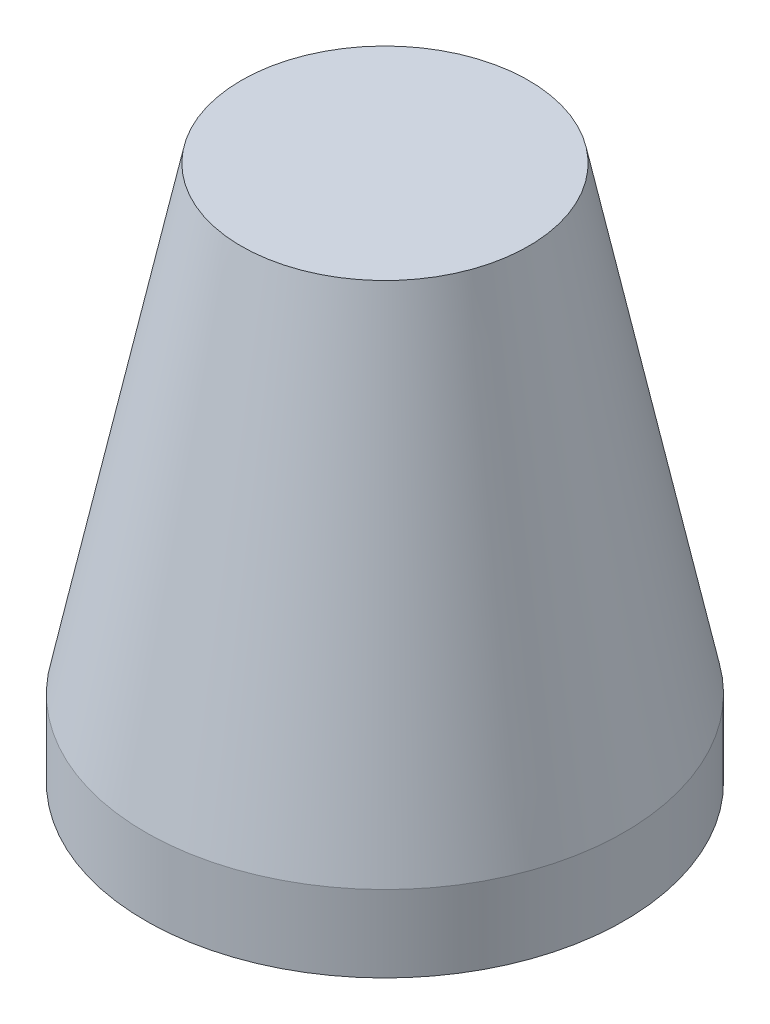
from build123d import *


with BuildPart() as part:
    # 草图1 → 旋转1 (revolve)
    with BuildSketch(Plane.XY):
        Polygon((0, 56), (0, 0), (-25, 0), (-25, 8), (-15, 56), align=None)
    revolve(axis=Axis((0, 56, 0), (0, -1, 0)))


solid = part.part
